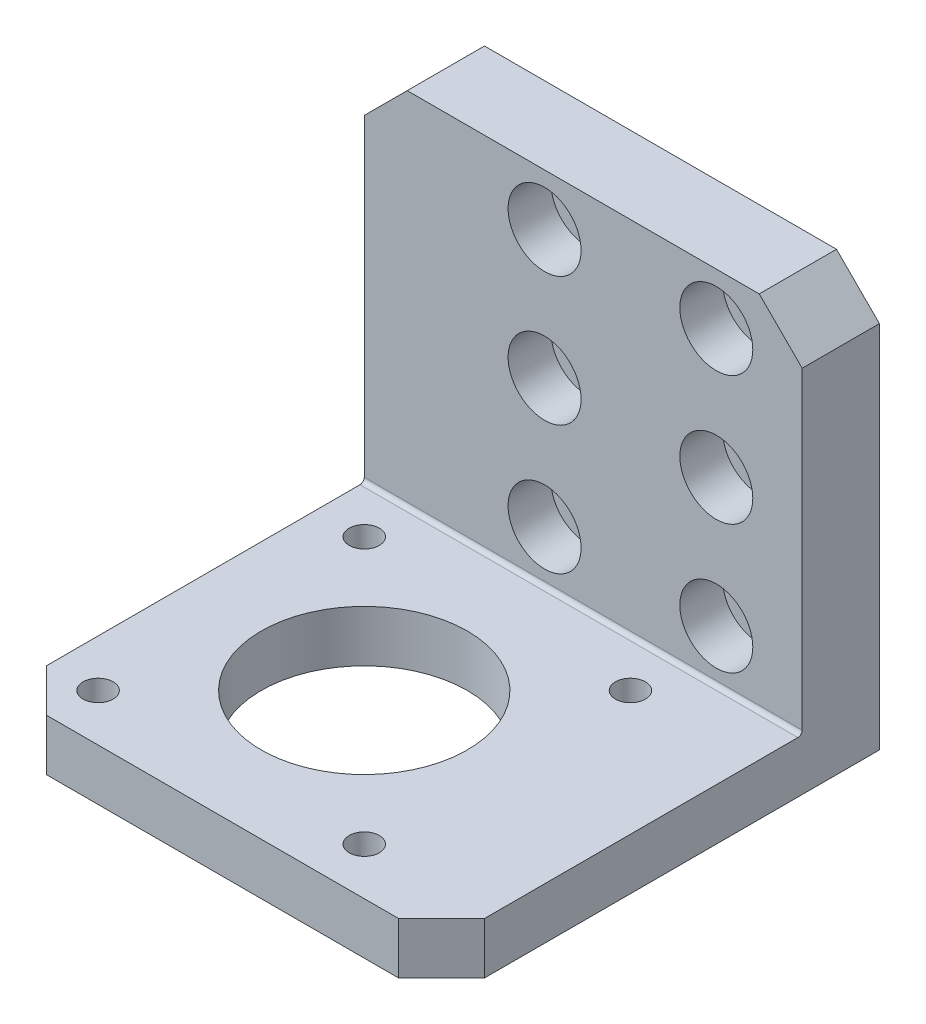
from build123d import *

# Parameters (mm, degrees)
SKETCH_1_R          = 2.75
EXTRUDE_1_DEPTH     = 9
SKETCH_3_W          = 42
SKETCH_3_H          = 42
SKETCH_3_R          = 1.75
SKETCH_3_R_2        = 12
EXTRUDE_2_DEPTH     = 6
SKETCH_4_R          = 3
CUT_EXTRUDE_2_DEPTH = 3
SKETCH_5_W          = 42
SKETCH_5_H          = 9
EXTRUDE_3_DEPTH     = 6
SKETCH_6_R          = 4.25
CUT_EXTRUDE_3_DEPTH = 5
CHAMFER_2_SIZE      = 5
SKETCH_7_W          = 51
SKETCH_7_H          = 6
EXTRUDE_4_DEPTH     = 9
CHAMFER_3_SIZE      = 5
FILLET_1_R          = 0.5


with BuildPart() as part:
    # 草圖1 → 填料-伸長1 (new body)
    with BuildSketch(Plane.XY):
        Polygon((30, 21), (21, 21), (-21, 21), (-21, -21), (21, -21), (30, -21), align=None)
        with Locations((0, 15)):
            Circle(SKETCH_1_R, mode=Mode.SUBTRACT)
        with Locations((20, 15)):
            Circle(SKETCH_1_R, mode=Mode.SUBTRACT)
        with Locations((20, 0)):
            Circle(SKETCH_1_R, mode=Mode.SUBTRACT)
        with Locations((20, -15)):
            Circle(SKETCH_1_R, mode=Mode.SUBTRACT)
        Circle(SKETCH_1_R, mode=Mode.SUBTRACT)
        with Locations((0, -15)):
            Circle(SKETCH_1_R, mode=Mode.SUBTRACT)
    extrude(amount=EXTRUDE_1_DEPTH)



with BuildPart() as body_2:
    # 草圖3 → 填料-伸長2 (new body)
    with BuildSketch(Plane.XZ.offset(21)):
        with Locations((0, 30)):
            Rectangle(SKETCH_3_W, SKETCH_3_H)
        with Locations(Location((-15.5, 45.5, 0), (0, 0, 270))):
            Circle(SKETCH_3_R, mode=Mode.SUBTRACT)
        with Locations(Location((-15.5, 14.5, 0), (0, 0, 90))):
            Circle(SKETCH_3_R, mode=Mode.SUBTRACT)
        with Locations(Location((15.5, 14.5, 0), (0, 0, 270))):
            Circle(SKETCH_3_R, mode=Mode.SUBTRACT)
        with Locations(Location((15.5, 45.5, 0), (0, 0, 90))):
            Circle(SKETCH_3_R, mode=Mode.SUBTRACT)
        with Locations(Location((0, 30, 0), (0, 0, 270))):
            Circle(SKETCH_3_R_2, mode=Mode.SUBTRACT)
    extrude(amount=EXTRUDE_2_DEPTH)

    # 草圖4 → 除料-伸長2 (cut)
    with BuildSketch(Plane.XZ.offset(27)):
        with Locations(Location((-15.5, 45.5, 0), (0, 0, 270))):
            Circle(SKETCH_4_R)
        with Locations(Location((-15.5, 14.5, 0), (0, 0, 90))):
            Circle(SKETCH_4_R)
        with Locations(Location((15.5, 14.5, 0), (0, 0, 270))):
            Circle(SKETCH_4_R)
        with Locations(Location((15.5, 45.5, 0), (0, 0, 90))):
            Circle(SKETCH_4_R)
    extrude(amount=-CUT_EXTRUDE_2_DEPTH, mode=Mode.SUBTRACT)


with BuildPart() as part_1:
    add(part.part)

    add(body_2.part)  # 填料-伸長3 merges body 2
    # 草圖5 → 填料-伸長3 (add)
    with BuildSketch(Plane.XZ.offset(21)):
        with Locations((0, 4.5)):
            Rectangle(SKETCH_5_W, SKETCH_5_H)
    extrude(amount=EXTRUDE_3_DEPTH)

    # 草圖6 → 除料-伸長3 (cut)
    with BuildSketch(Plane.XY.offset(9)):
        with Locations((0, 15)):
            Circle(SKETCH_6_R)
        with Locations((20, 15)):
            Circle(SKETCH_6_R)
        with Locations((20, 0)):
            Circle(SKETCH_6_R)
        with Locations((20, -15)):
            Circle(SKETCH_6_R)
        Circle(SKETCH_6_R)
        with Locations((0, -15)):
            Circle(SKETCH_6_R)
    extrude(amount=-CUT_EXTRUDE_3_DEPTH, mode=Mode.SUBTRACT)

    # 導角2
    chamfer_2_edges = [part_1.edges().sort_by_distance(p)[0] for p in [
        (-21, 21, 4.5),
        (30, 21, 4.5),
    ]]
    chamfer(chamfer_2_edges, length=CHAMFER_2_SIZE)

    # 草圖7 → 填料-伸長4 (add)
    with BuildSketch(Plane(origin=(21, 0, 0), x_dir=(0, 0, -1), z_dir=(1, 0, 0))):
        with Locations((-25.5, -24)):
            Rectangle(SKETCH_7_W, SKETCH_7_H)
    extrude(amount=EXTRUDE_4_DEPTH)

    # 導角3
    chamfer_3_edges = [part_1.edges().sort_by_distance(p)[0] for p in [
        (30, -24, 51),
        (-21, -24, 51),
    ]]
    chamfer(chamfer_3_edges, length=CHAMFER_3_SIZE)

    # 圓角1
    fillet_1_edges = [part_1.edges().sort_by_distance(p)[0] for p in [
        (4.5, -21, 9),
    ]]
    fillet(fillet_1_edges, radius=FILLET_1_R)


solid = part_1.part
